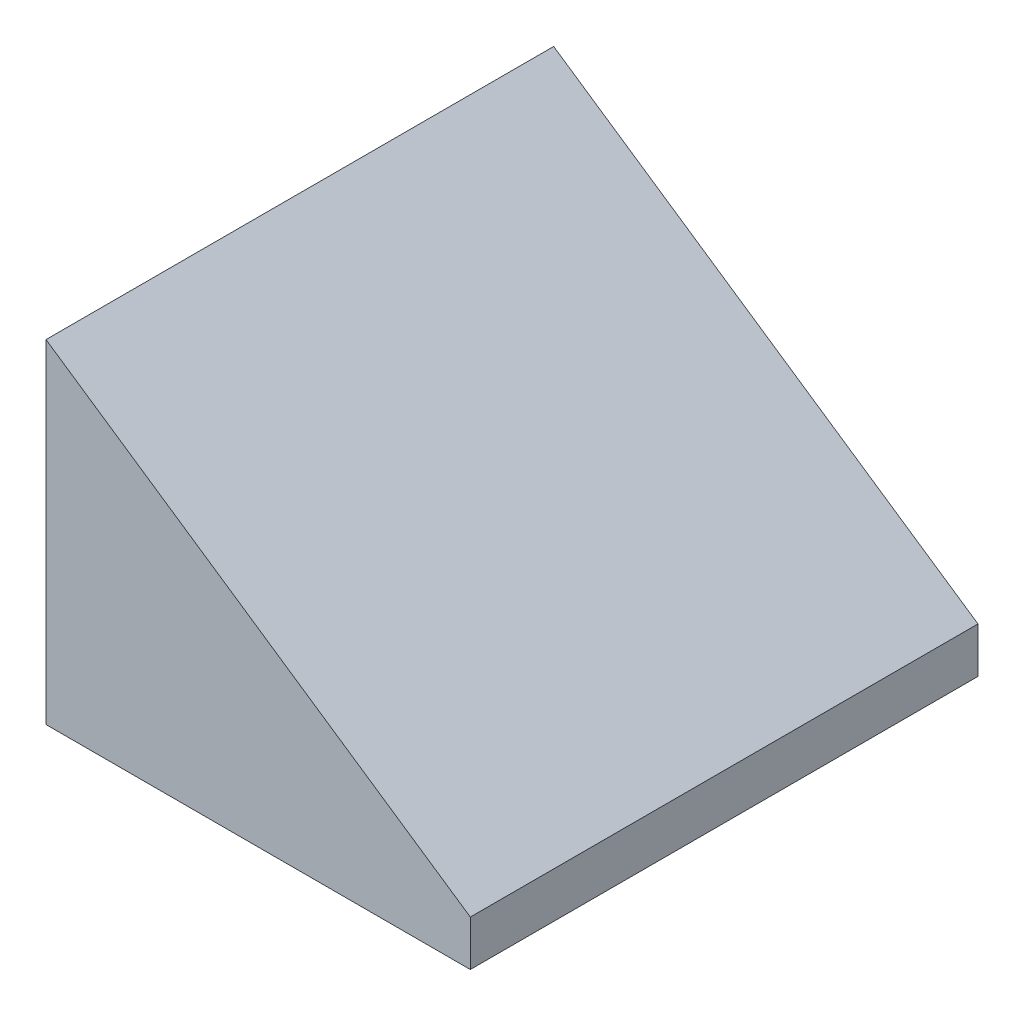
from build123d import *

# Parameters (mm, degrees)
SKETCH1_W           = 28
SKETCH1_H           = 33.5
BOSS_EXTRUDE1_DEPTH = 22
CUT_EXTRUDE1_DEPTH  = 44


with BuildPart() as part:
    # Sketch1 → Boss-Extrude1 (new body)
    with BuildSketch(Plane(origin=(0, 0, 0), x_dir=(1, 0, 0), z_dir=(0, 1, 0))):
        Rectangle(SKETCH1_W, SKETCH1_H)
    extrude(amount=BOSS_EXTRUDE1_DEPTH)

    # Sketch3 → Cut-Extrude1 (cut)
    with BuildSketch(Plane.XY.offset(16.75)):
        Polygon((14, 22), (-14, 22), (14, 3), align=None)
    extrude(amount=-CUT_EXTRUDE1_DEPTH, mode=Mode.SUBTRACT)


solid = part.part
